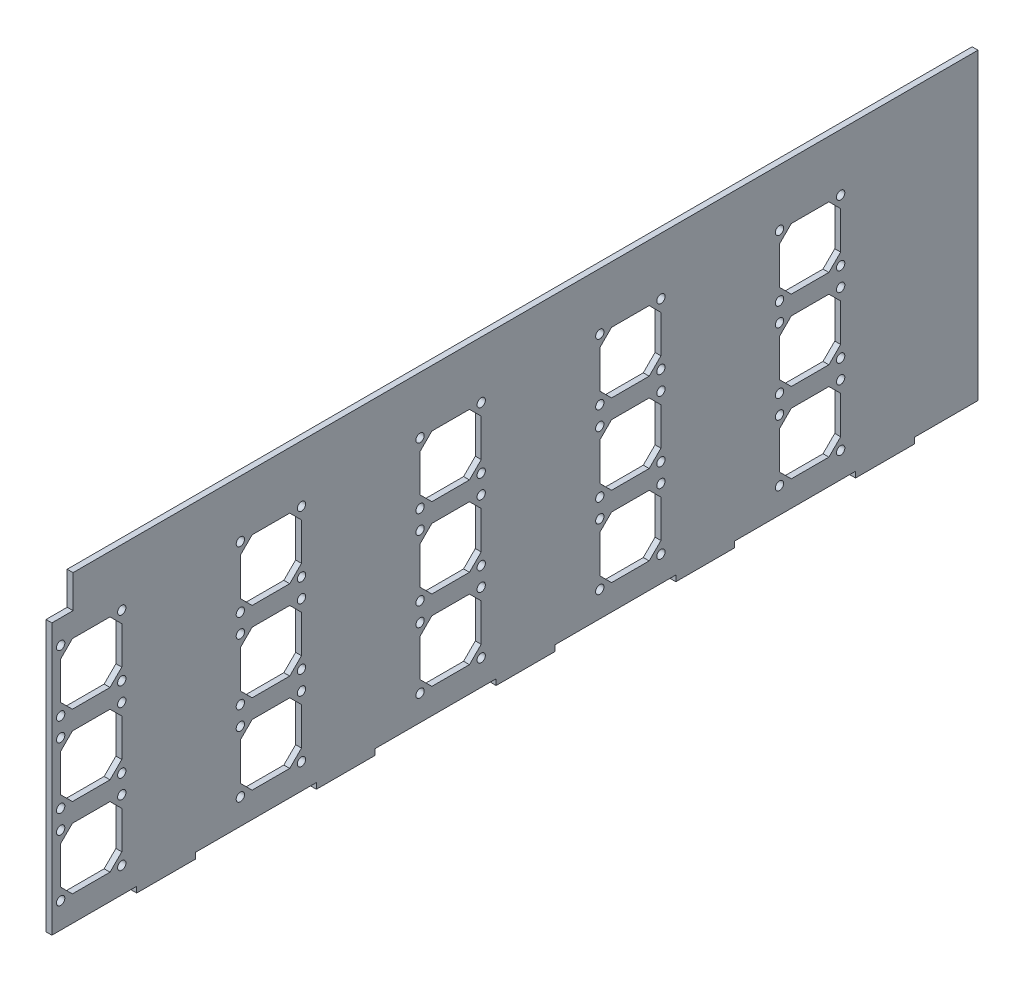
from build123d import *

# Parameters (mm, degrees)
BOSS_EXTRUDE2_DEPTH     = 3.175
SKETCH3_W               = 488.569
SKETCH3_H               = 17.78
BOSS_EXTRUDE3_DEPTH     = 3.175
CUT_EXTRUDE5_DEPTH      = 272.37710692
CUT_EXTRUDE5_DEPTH_BACK = 272.37710692
SKETCH6_R               = 2.25
CUT_EXTRUDE7_DEPTH      = 272.37710692
CUT_EXTRUDE7_DEPTH_BACK = 272.37710692


with BuildPart() as part:
    # Sketch1 → Boss-Extrude2 (new body)
    with BuildSketch(Plane(origin=(0, 0, 0), x_dir=(0, 0, -1), z_dir=(1, 0, 0))):
        Polygon((-244.2845, 73.025), (244.2845, 73.025), (244.2845, 47.625), (244.2845, -60.325), (244.2845, -73.025), (209.931, -73.025), (209.931, -76.2), (178.181, -76.2), (178.181, -73.025), (112.903, -73.025), (112.903, -76.2), (81.153, -76.2), (81.153, -73.025), (15.875, -73.025), (15.875, -76.2), (-15.875, -76.2), (-15.875, -73.025), (-81.153, -73.025), (-81.153, -76.2), (-112.903, -76.2), (-112.903, -73.025), (-178.181, -73.025), (-178.181, -76.2), (-209.931, -76.2), (-209.931, -73.025), (-244.2845, -73.025), (-255.7145, -73.025), (-255.7145, 73.025), align=None)
    extrude(amount=BOSS_EXTRUDE2_DEPTH)

    # Sketch3 → Boss-Extrude3 (add)
    with BuildSketch(Plane(origin=(3.175, 0, 0), x_dir=(0, 0, -1), z_dir=(1, 0, 0))):
        with Locations((0, 81.915)):
            Rectangle(SKETCH3_W, SKETCH3_H)
    extrude(amount=-BOSS_EXTRUDE3_DEPTH)

    # Sketch6 → Cut-Extrude5 (cut, two sides: drawn at the far end of the back side and taken through both)
    with BuildSketch(Plane(origin=(3.175, 0, 0), x_dir=(0, 0, -1), z_dir=(1, 0, 0)).offset(-CUT_EXTRUDE5_DEPTH_BACK)):
        with Locations((-250.983288738, 60.140429672)):
            Circle(SKETCH6_R)
        with Locations(Location((-217.983288698, 60.140429672, 0), (0, 0, 180))):
            Circle(SKETCH6_R)
        with Locations((-250.983288738, 27.120429672)):
            Circle(SKETCH6_R)
        with Locations(Location((-217.983288698, 27.120429672, 0), (0, 0, 180))):
            Circle(SKETCH6_R)
        with Locations((-250.983288738, 16.960429672)):
            Circle(SKETCH6_R)
        with Locations((-250.983288738, -16.059570328)):
            Circle(SKETCH6_R)
        with Locations(Location((-217.983288698, -16.059570328, 0), (0, 0, 180))):
            Circle(SKETCH6_R)
        with Locations(Location((-217.983288698, 16.960429672, 0), (0, 0, 180))):
            Circle(SKETCH6_R)
        with Locations((-250.983288738, -26.219570328)):
            Circle(SKETCH6_R)
        with Locations((-250.983288738, -59.239570328)):
            Circle(SKETCH6_R)
        with Locations(Location((-217.983288698, -59.239570328, 0), (0, 0, 180))):
            Circle(SKETCH6_R)
        with Locations(Location((-217.983288698, -26.219570328, 0), (0, 0, 180))):
            Circle(SKETCH6_R)
        with Locations((-153.955288738, 60.140429672)):
            Circle(SKETCH6_R)
        with Locations(Location((-120.955288698, 60.140429672, 0), (0, 0, 180))):
            Circle(SKETCH6_R)
        with Locations((-153.955288738, 27.120429672)):
            Circle(SKETCH6_R)
        with Locations(Location((-120.955288698, 16.960429672, 0), (0, 0, 180))):
            Circle(SKETCH6_R)
        with Locations((-153.955288738, 16.960429672)):
            Circle(SKETCH6_R)
        with Locations((-153.955288738, -16.059570328)):
            Circle(SKETCH6_R)
        with Locations(Location((-120.955288698, 27.120429672, 0), (0, 0, 180))):
            Circle(SKETCH6_R)
        with Locations(Location((-120.955288698, -16.059570328, 0), (0, 0, 180))):
            Circle(SKETCH6_R)
        with Locations(Location((-120.955288698, -26.219570328, 0), (0, 0, 180))):
            Circle(SKETCH6_R)
        with Locations((-153.955288738, -26.219570328)):
            Circle(SKETCH6_R)
        with Locations((-153.955288738, -59.239570328)):
            Circle(SKETCH6_R)
        with Locations(Location((-120.955288698, -59.239570328, 0), (0, 0, 180))):
            Circle(SKETCH6_R)
        with Locations((-56.927288738, 60.140429672)):
            Circle(SKETCH6_R)
        with Locations(Location((-23.927288698, 60.140429672, 0), (0, 0, 180))):
            Circle(SKETCH6_R)
        with Locations((-56.927288738, 27.120429672)):
            Circle(SKETCH6_R)
        with Locations(Location((-23.927288698, 16.960429672, 0), (0, 0, 180))):
            Circle(SKETCH6_R)
        with Locations((-56.927288738, 16.960429672)):
            Circle(SKETCH6_R)
        with Locations((-56.927288738, -16.059570328)):
            Circle(SKETCH6_R)
        with Locations(Location((-23.927288698, 27.120429672, 0), (0, 0, 180))):
            Circle(SKETCH6_R)
        with Locations(Location((-23.927288698, -16.059570328, 0), (0, 0, 180))):
            Circle(SKETCH6_R)
        with Locations(Location((-23.927288698, -26.219570328, 0), (0, 0, 180))):
            Circle(SKETCH6_R)
        with Locations((-56.927288738, -26.219570328)):
            Circle(SKETCH6_R)
        with Locations((-56.927288738, -59.239570328)):
            Circle(SKETCH6_R)
        with Locations(Location((-23.927288698, -59.239570328, 0), (0, 0, 180))):
            Circle(SKETCH6_R)
        with Locations((40.100711262, 60.140429672)):
            Circle(SKETCH6_R)
        with Locations(Location((73.100711302, 60.140429672, 0), (0, 0, 180))):
            Circle(SKETCH6_R)
        with Locations((40.100711262, 27.120429672)):
            Circle(SKETCH6_R)
        with Locations(Location((73.100711302, 16.960429672, 0), (0, 0, 180))):
            Circle(SKETCH6_R)
        with Locations((40.100711262, 16.960429672)):
            Circle(SKETCH6_R)
        with Locations((40.100711262, -16.059570328)):
            Circle(SKETCH6_R)
        with Locations(Location((73.100711302, 27.120429672, 0), (0, 0, 180))):
            Circle(SKETCH6_R)
        with Locations(Location((73.100711302, -16.059570328, 0), (0, 0, 180))):
            Circle(SKETCH6_R)
        with Locations(Location((73.100711302, -26.219570328, 0), (0, 0, 180))):
            Circle(SKETCH6_R)
        with Locations((40.100711262, -26.219570328)):
            Circle(SKETCH6_R)
        with Locations((40.100711262, -59.239570328)):
            Circle(SKETCH6_R)
        with Locations(Location((73.100711302, -59.239570328, 0), (0, 0, 180))):
            Circle(SKETCH6_R)
        with Locations((137.128711262, 60.140429672)):
            Circle(SKETCH6_R)
        with Locations(Location((170.128711302, 60.140429672, 0), (0, 0, 180))):
            Circle(SKETCH6_R)
        with Locations((137.128711262, 27.120429672)):
            Circle(SKETCH6_R)
        with Locations(Location((170.128711302, 16.960429672, 0), (0, 0, 180))):
            Circle(SKETCH6_R)
        with Locations((137.128711262, 16.960429672)):
            Circle(SKETCH6_R)
        with Locations((137.128711262, -16.059570328)):
            Circle(SKETCH6_R)
        with Locations(Location((170.128711302, 27.120429672, 0), (0, 0, 180))):
            Circle(SKETCH6_R)
        with Locations(Location((170.128711302, -16.059570328, 0), (0, 0, 180))):
            Circle(SKETCH6_R)
        with Locations(Location((170.128711302, -26.219570328, 0), (0, 0, 180))):
            Circle(SKETCH6_R)
        with Locations((137.128711262, -26.219570328)):
            Circle(SKETCH6_R)
        with Locations((137.128711262, -59.239570328)):
            Circle(SKETCH6_R)
        with Locations(Location((170.128711302, -59.239570328, 0), (0, 0, 180))):
            Circle(SKETCH6_R)
    extrude(amount=CUT_EXTRUDE5_DEPTH + CUT_EXTRUDE5_DEPTH_BACK, mode=Mode.SUBTRACT)

    # Sketch8 → Cut-Extrude7 (cut, two sides: drawn at the far end of the back side and taken through both)
    with BuildSketch(Plane(origin=(3.175, 0, 0), x_dir=(0, 0, -1), z_dir=(1, 0, 0)).offset(-CUT_EXTRUDE7_DEPTH_BACK)):
        Polygon((-250.983288698, 53.790429672), (-244.633288738, 60.130429672), (-224.333288698, 60.130429672), (-217.983288738, 53.790429672), (-217.983288738, 33.470429672), (-224.333288698, 27.130429672), (-244.633288738, 27.130429672), (-250.983288698, 33.470429672), align=None)
        Polygon((-250.983288698, 10.610429672), (-244.633288738, 16.950429672), (-224.333288698, 16.950429672), (-217.983288738, 10.610429672), (-217.983288738, -9.709570328), (-224.333288698, -16.049570328), (-244.633288738, -16.049570328), (-250.983288698, -9.709570328), align=None)
        Polygon((-250.983288698, -32.569570328), (-244.633288738, -26.229570328), (-224.333288698, -26.229570328), (-217.983288738, -32.569570328), (-217.983288738, -52.889570328), (-224.333288698, -59.229570328), (-244.633288738, -59.229570328), (-250.983288698, -52.889570328), align=None)
        Polygon((-153.955288698, 53.790429672), (-147.605288738, 60.130429672), (-127.305288698, 60.130429672), (-120.955288738, 53.790429672), (-120.955288738, 33.470429672), (-127.305288698, 27.130429672), (-147.605288738, 27.130429672), (-153.955288698, 33.470429672), align=None)
        Polygon((-147.605288738, 16.950429672), (-127.305288698, 16.950429672), (-120.955288738, 10.610429672), (-120.955288738, -9.709570328), (-127.305288698, -16.049570328), (-147.605288738, -16.049570328), (-153.955288698, -9.709570328), (-153.955288698, 10.610429672), align=None)
        Polygon((-120.955288738, -52.889570328), (-127.305288698, -59.229570328), (-147.605288738, -59.229570328), (-153.955288698, -52.889570328), (-153.955288698, -32.569570328), (-147.605288738, -26.229570328), (-127.305288698, -26.229570328), (-120.955288738, -32.569570328), align=None)
        Polygon((-56.927288698, 53.790429672), (-50.577288738, 60.130429672), (-30.277288698, 60.130429672), (-23.927288738, 53.790429672), (-23.927288738, 33.470429672), (-30.277288698, 27.130429672), (-50.577288738, 27.130429672), (-56.927288698, 33.470429672), align=None)
        Polygon((-50.577288738, 16.950429672), (-30.277288698, 16.950429672), (-23.927288738, 10.610429672), (-23.927288738, -9.709570328), (-30.277288698, -16.049570328), (-50.577288738, -16.049570328), (-56.927288698, -9.709570328), (-56.927288698, 10.610429672), align=None)
        Polygon((-23.927288738, -52.889570328), (-30.277288698, -59.229570328), (-50.577288738, -59.229570328), (-56.927288698, -52.889570328), (-56.927288698, -32.569570328), (-50.577288738, -26.229570328), (-30.277288698, -26.229570328), (-23.927288738, -32.569570328), align=None)
        Polygon((40.100711302, 53.790429672), (46.450711262, 60.130429672), (66.750711302, 60.130429672), (73.100711262, 53.790429672), (73.100711262, 33.470429672), (66.750711302, 27.130429672), (46.450711262, 27.130429672), (40.100711302, 33.470429672), align=None)
        Polygon((46.450711262, 16.950429672), (66.750711302, 16.950429672), (73.100711262, 10.610429672), (73.100711262, -9.709570328), (66.750711302, -16.049570328), (46.450711262, -16.049570328), (40.100711302, -9.709570328), (40.100711302, 10.610429672), align=None)
        Polygon((73.100711262, -52.889570328), (66.750711302, -59.229570328), (46.450711262, -59.229570328), (40.100711302, -52.889570328), (40.100711302, -32.569570328), (46.450711262, -26.229570328), (66.750711302, -26.229570328), (73.100711262, -32.569570328), align=None)
        Polygon((137.128711302, 53.790429672), (143.478711262, 60.130429672), (163.778711302, 60.130429672), (170.128711262, 53.790429672), (170.128711262, 33.470429672), (163.778711302, 27.130429672), (143.478711262, 27.130429672), (137.128711302, 33.470429672), align=None)
        Polygon((143.478711262, 16.950429672), (163.778711302, 16.950429672), (170.128711262, 10.610429672), (170.128711262, -9.709570328), (163.778711302, -16.049570328), (143.478711262, -16.049570328), (137.128711302, -9.709570328), (137.128711302, 10.610429672), align=None)
        Polygon((170.128711262, -52.889570328), (163.778711302, -59.229570328), (143.478711262, -59.229570328), (137.128711302, -52.889570328), (137.128711302, -32.569570328), (143.478711262, -26.229570328), (163.778711302, -26.229570328), (170.128711262, -32.569570328), align=None)
    extrude(amount=CUT_EXTRUDE7_DEPTH + CUT_EXTRUDE7_DEPTH_BACK, mode=Mode.SUBTRACT)


solid = part.part
